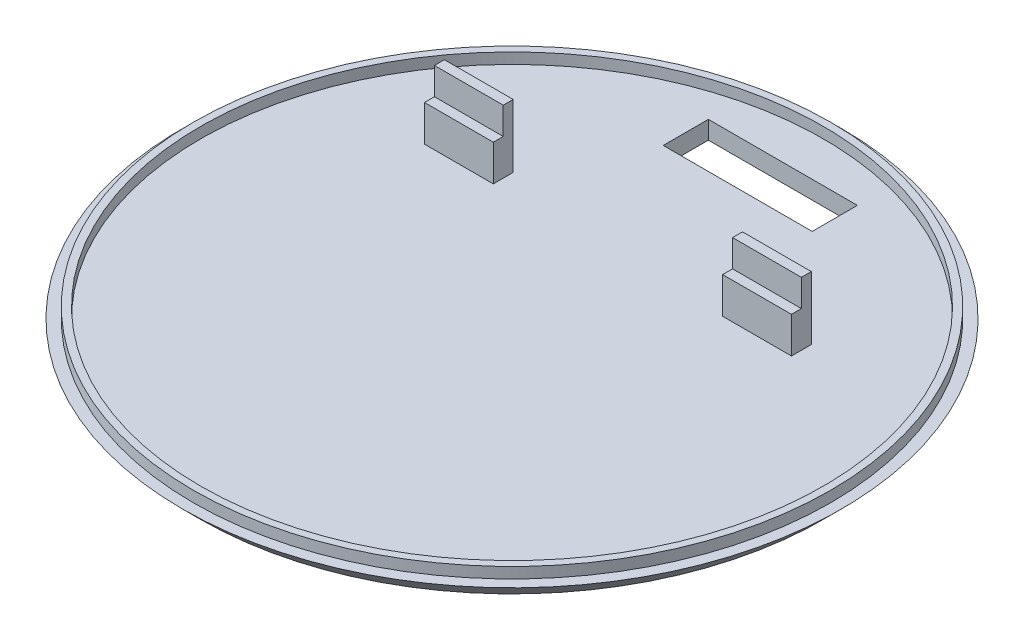
from build123d import *

# Parameters (mm, degrees)
SKETCH2_W           = 0.8
SKETCH2_H           = 1.2
CUT_EXTRUDE2_REACH  = 53.658
SKETCH3_W           = 16.5
SKETCH3_H           = 5
SKETCH4_W           = 7.62
SKETCH4_H           = 2.2
BOSS_EXTRUDE1_DEPTH = 4
SKETCH5_W           = 7.62
SKETCH5_H           = 1.1
BOSS_EXTRUDE2_DEPTH = 3


with BuildPart() as part:
    # Sketch2 → Revolve1 (revolve)
    with BuildSketch(Plane.XY, mode=Mode.PRIVATE) as revolve1_sk:
        Polygon((0, -2), (0, 0), (36.5, 0), (34.5, -2), align=None)
        with Locations((34.9, 0.6)):
            Rectangle(SKETCH2_W, SKETCH2_H)
    revolve(revolve1_sk.sketch.rotate(Axis((0, 31.706596317, 0), (0, -1, 0)), 90), axis=Axis((0, 31.706596317, 0), (0, -1, 0)))

    # Sketch3 → Cut-Extrude2 (cut, up to next)
    with BuildSketch(Plane(origin=(0, 0, 0), x_dir=(1, 0, 0), z_dir=(0, 1, 0)), mode=Mode.PRIVATE) as cut_extrude2_sk1:
        with Locations((0, 27.5)):
            Rectangle(SKETCH3_W, SKETCH3_H)
    cut_extrude2_tool1 = extrude(cut_extrude2_sk1.sketch, amount=-CUT_EXTRUDE2_REACH, mode=Mode.PRIVATE) & part.part
    add(cut_extrude2_tool1.solids().sort_by_distance((0, 0, -27.5))[0], mode=Mode.SUBTRACT)

    # Sketch4 → Boss-Extrude1 (add)
    with BuildSketch(Plane(origin=(0, 0, 0), x_dir=(1, 0, 0), z_dir=(0, 1, 0))):
        with Locations((-17.78, 13)):
            Rectangle(SKETCH4_W, SKETCH4_H)
        with Locations((15.24, 13)):
            Rectangle(SKETCH4_W, SKETCH4_H)
    extrude(amount=BOSS_EXTRUDE1_DEPTH)

    # Sketch5 → Boss-Extrude2 (add)
    with BuildSketch(Plane(origin=(0, 4, 0), x_dir=(1, 0, 0), z_dir=(0, 1, 0))):
        with Locations((-17.78, 13.55)):
            Rectangle(SKETCH5_W, SKETCH5_H)
        with Locations((15.24, 13.55)):
            Rectangle(SKETCH5_W, SKETCH5_H)
    extrude(amount=BOSS_EXTRUDE2_DEPTH)


solid = part.part
